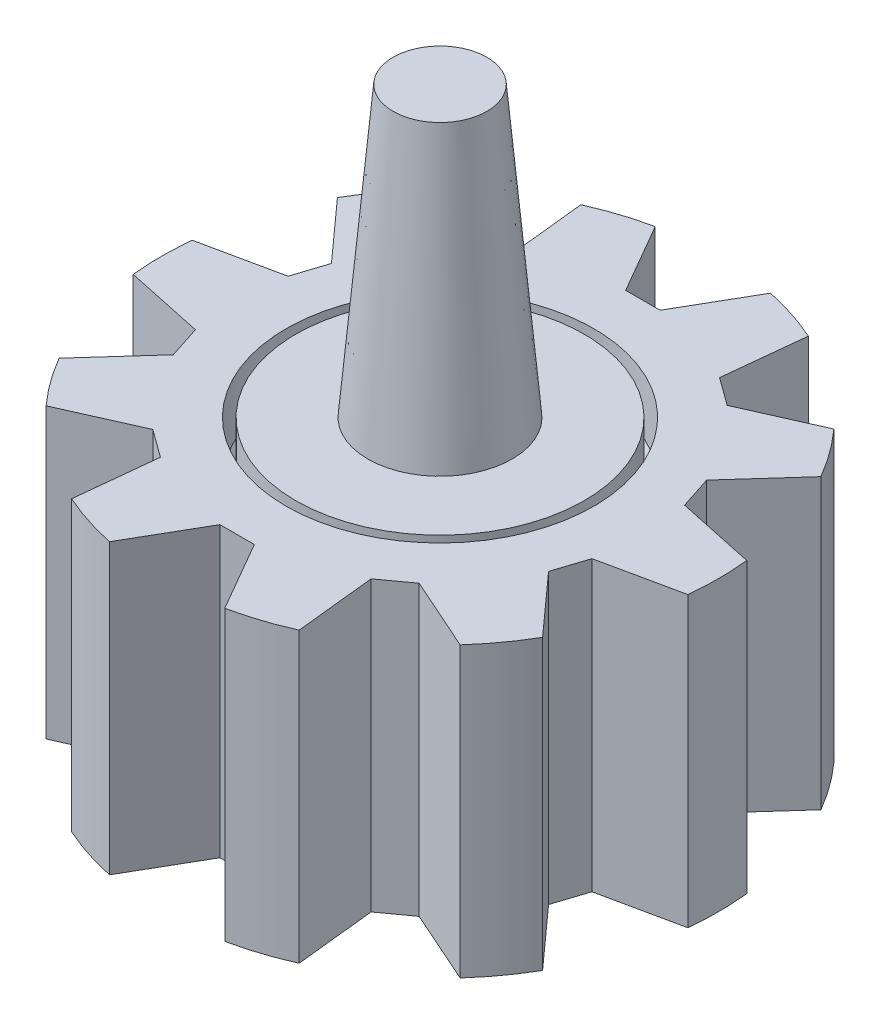
from build123d import *

# Parameters (mm, degrees)
CUT_EXTRUDE1_DEPTH  = 51.813384064
CIRPATTERN1_COUNT   = 10
SKETCH4_R           = 7.5
BOSS_EXTRUDE1_DEPTH = 30
BOSS_EXTRUDE1_TAPER = 5


with BuildPart() as part:
    # Sketch1 → Revolve1 (revolve)
    with BuildSketch(Plane.XY, mode=Mode.PRIVATE) as revolve1_sk:
        Polygon((15, 30), (15, 25), (10, 20), (10, 10), (15, 5), (15, 0), (0, 0), (0, 30), align=None)
    revolve(revolve1_sk.sketch.rotate(Axis((0, 67.578947368, 0), (0, -1, 0)), 90), axis=Axis((0, 67.578947368, 0), (0, -1, 0)))

    # Sketch4 → Boss-Extrude1 (add)
    with BuildSketch(Plane(origin=(0, 30, 0), x_dir=(1, 0, 0), z_dir=(0, 1, 0))):
        Circle(SKETCH4_R)
    extrude(amount=BOSS_EXTRUDE1_DEPTH, taper=BOSS_EXTRUDE1_TAPER)


with BuildPart() as body_2:
    # Sketch2 → Revolve2 (revolve)
    with BuildSketch(Plane.XY, mode=Mode.PRIVATE) as revolve2_sk:
        Polygon((16, 30), (29, 30), (29, 0), (16, 0), (16, 5.828427125), (11, 10.828427125), (11, 19.171572875), (16, 24.171572875), align=None)
    revolve(revolve2_sk.sketch.rotate(Axis((0, 82.985543577, 0), (0, -1, 0)), 90), axis=Axis((0, 82.985543577, 0), (0, -1, 0)))

    # Sketch8 → Cut-Extrude1 (cut, through all)
    with BuildSketch(Plane.XZ):
        Polygon((-1.790438074, -21.095246631), (1.790438074, -21.095246631), (10.81715224, -36.729974192), (-10.81715224, -36.729974192), align=None)
    cut_extrude1 = extrude(amount=-CUT_EXTRUDE1_DEPTH, mode=Mode.SUBTRACT)

    # CirPattern1: Cut-Extrude1 ×10 about axis
    cirpattern1_axis = Axis((0, 0, 0), (0, 1, 0))
    for i in range(1, CIRPATTERN1_COUNT):
        add(cut_extrude1.rotate(cirpattern1_axis, i * 360 / CIRPATTERN1_COUNT), mode=Mode.SUBTRACT)


solid = Compound([part.part, body_2.part])
